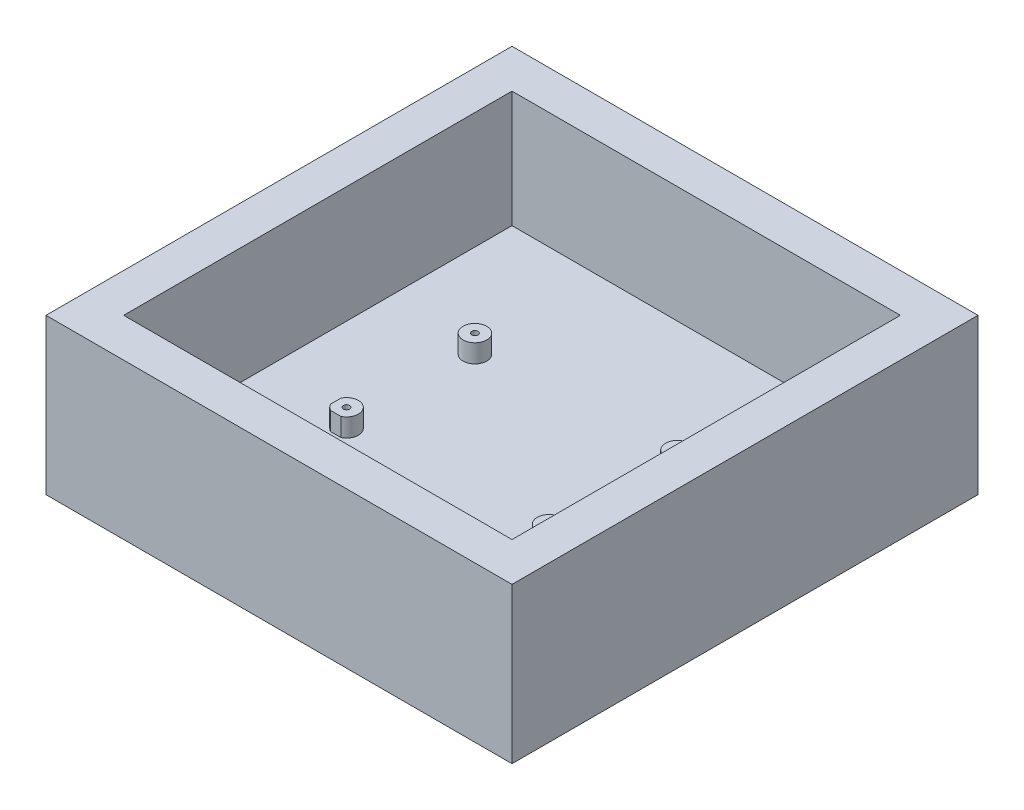
from build123d import *

# Parameters (mm, degrees)
SKETCH1_W                    = 152.4
SKETCH1_H                    = 50.8
BOSS_EXTRUDE2_DEPTH          = 152.4
SHELL1_T                     = -12.7
SKETCH2_R                    = 3.877794573
BOSS_EXTRUDE3_DEPTH          = 6
M2_5X0_45_TAPPED_HOLE3_D     = 2.05
M2_5X0_45_TAPPED_HOLE3_DEPTH = 4.99999
M2_5X0_45_TAPPED_HOLE3_TIP   = 0.615882135


with BuildPart() as part:
    # Sketch1 → Boss-Extrude2 (new body)
    with BuildSketch(Plane.XY):
        with Locations((65.122807232, 229.754701441)):
            Rectangle(SKETCH1_W, SKETCH1_H)
    extrude(amount=BOSS_EXTRUDE2_DEPTH)

    # Shell1
    shell1_openings = [part.faces().sort_by_distance(p)[0] for p in [
        (65.122807232, 255.154701441, 76.2),
    ]]
    offset(amount=SHELL1_T, openings=shell1_openings, kind=Kind.INTERSECTION)

    # Sketch2 → Boss-Extrude3 (add)
    with BuildSketch(Plane(origin=(0, 217.054701441, 0), x_dir=(1, 0, 0), z_dir=(0, 1, 0))):
        with Locations(Location((32.002807193, -55.2, 0), (0, 0, 270))):
            Circle(SKETCH2_R)
        with BuildLine():
            Line((99.91232539, -51.7), (96.573289151, -51.7))
            ThreePointArc((96.573289151, -51.7), (95.500792432, -57.942014839), (101.742807271, -56.869518119))
            Line((101.742807271, -56.869518119), (101.742807271, -53.530481881))
            ThreePointArc((101.742807271, -53.530481881), (100.984822109, -52.457985161), (99.91232539, -51.7))
        make_face()
        with BuildLine():
            ThreePointArc((33.672325312, -100.7), (34.744822031, -94.457985161), (28.502807193, -95.530481881))
            Line((28.502807193, -95.530481881), (28.502807193, -98.869518119))
            ThreePointArc((28.502807193, -98.869518119), (29.260792354, -99.942014839), (30.333289073, -100.7))
            Line((30.333289073, -100.7), (33.672325312, -100.7))
        make_face()
        with BuildLine():
            Line((101.742807271, -98.869518119), (101.742807271, -95.530481881))
            ThreePointArc((101.742807271, -95.530481881), (95.500792432, -94.457985161), (96.573289151, -100.7))
            Line((96.573289151, -100.7), (99.91232539, -100.7))
            ThreePointArc((99.91232539, -100.7), (100.984822109, -99.942014839), (101.742807271, -98.869518119))
        make_face()
    extrude(amount=BOSS_EXTRUDE3_DEPTH)

    # M2.5x0.45 Tapped Hole3
    with Locations(Plane(origin=(0, 223.054701441, 0), x_dir=(1, 0, 0), z_dir=(0, 1, 0))):
        with Locations((32.002807193, -55.2), (98.242807271, -55.2), (98.242807271, -97.2), (32.002807193, -97.2)):
            Hole(M2_5X0_45_TAPPED_HOLE3_D / 2, depth=M2_5X0_45_TAPPED_HOLE3_DEPTH)
            with Locations((0, 0, -(M2_5X0_45_TAPPED_HOLE3_DEPTH + M2_5X0_45_TAPPED_HOLE3_TIP / 2))):  # 118° drill point
                Cone(0, M2_5X0_45_TAPPED_HOLE3_D / 2, M2_5X0_45_TAPPED_HOLE3_TIP, mode=Mode.SUBTRACT)


solid = part.part
